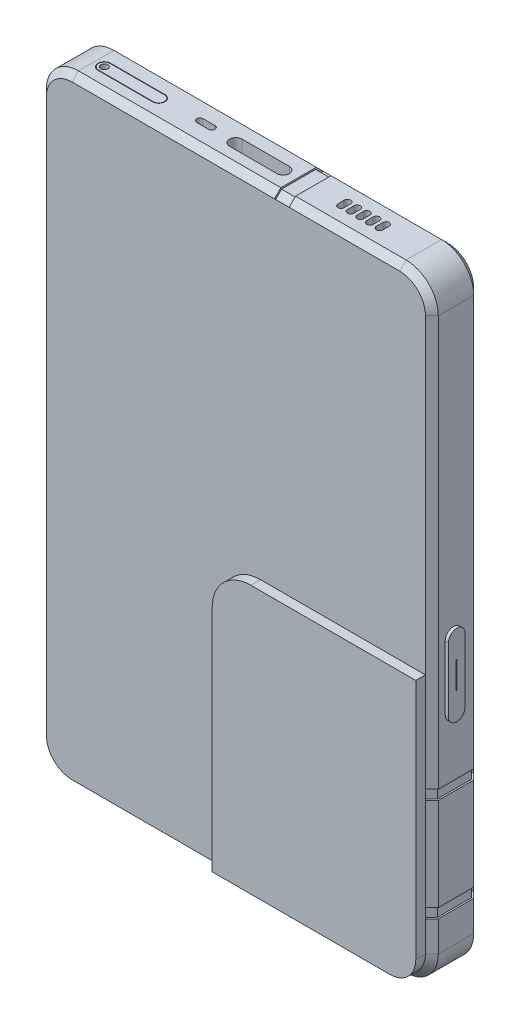
from build123d import *

# Parameters (mm, degrees)
EXTRUDE_1_DEPTH        = 15
CHAMFER_7_SIZE         = 2
CHAMFER_8_SIZE         = 2
CUT_EXTRUDE_1_DEPTH    = 6
PATTERN_LINEAR_1_COUNT = 5
PATTERN_LINEAR_1_PITCH = 3
CUT_EXTRUDE_2_DEPTH    = 10
CUT_EXTRUDE_3_DEPTH    = 40
CUT_EXTRUDE_5_DEPTH    = 20
EXTRUDE_2_DEPTH        = 20
SKETCH_9_R             = 1.114563032
CUT_EXTRUDE_6_DEPTH    = 20
SKETCH_10_R            = 2.990185925
CUT_EXTRUDE_8_DEPTH    = 20
SKETCH_12_W            = 4.560479379
SKETCH_12_H            = 11
CUT_EXTRUDE_9_DEPTH    = 0.5
SKETCH_13_W            = 4.560479379
SKETCH_13_H            = 2.828427125
CUT_EXTRUDE_10_DEPTH   = 0.5
SKETCH_14_W            = 4.560479379
SKETCH_14_H            = 2.828427125
CUT_EXTRUDE_11_DEPTH   = 0.5
EXTRUDE_3_DEPTH        = 1
EXTRUDE_4_DEPTH        = 0.1
SKETCH_17_W            = 11
SKETCH_17_H            = 3
CUT_EXTRUDE_12_DEPTH   = 0.5
SKETCH_18_W            = 2.828427124
SKETCH_18_H            = 3
CUT_EXTRUDE_13_DEPTH   = 0.5
SKETCH_19_W            = 2.828427124
SKETCH_19_H            = 3
CUT_EXTRUDE_14_DEPTH   = 0.5
EXTRUDE_5_DEPTH        = 0.5
SKETCH_26_W            = 11
SKETCH_26_H            = 4
CUT_EXTRUDE_15_DEPTH   = 0.5
SKETCH_27_W            = 2.828427124
SKETCH_27_H            = 4
CUT_EXTRUDE_16_DEPTH   = 0.5
SKETCH_28_W            = 2.828427124
SKETCH_28_H            = 4
CUT_EXTRUDE_17_DEPTH   = 0.5
EXTRUDE_6_DEPTH        = 3


with BuildPart() as part:
    # 草图1 → 凸台-拉伸1 (new body)
    with BuildSketch(Plane.XY):
        with BuildLine():
            Line((-50.87521941, 95.847945747), (50.87521941, 95.847945747))
            ThreePointArc((50.87521941, 95.847945747), (57.946287222, 92.919013559), (60.87521941, 85.847945747))
            Line((60.87521941, 85.847945747), (60.87521941, -85.847945747))
            ThreePointArc((60.87521941, -85.847945747), (57.946287222, -92.919013559), (50.87521941, -95.847945747))
            Line((50.87521941, -95.847945747), (-50.87521941, -95.847945747))
            ThreePointArc((-50.87521941, -95.847945747), (-57.946287222, -92.919013559), (-60.87521941, -85.847945747))
            Line((-60.87521941, -85.847945747), (-60.87521941, 85.847945747))
            ThreePointArc((-60.87521941, 85.847945747), (-57.946287222, 92.919013559), (-50.87521941, 95.847945747))
        make_face()
    extrude(amount=EXTRUDE_1_DEPTH)

    # 倒角7
    chamfer_7_edges = [part.edges().sort_by_distance(p)[0] for p in [
        (0, 95.847945747, 0),
        (57.946287222, 92.919013559, 0),
        (60.87521941, 0, 0),
        (57.946287222, -92.919013559, 0),
        (0, -95.847945747, 0),
        (-57.946287222, -92.919013559, 0),
        (-60.87521941, 0, 0),
        (-57.946287222, 92.919013559, 0),
    ]]
    chamfer(chamfer_7_edges, length=CHAMFER_7_SIZE)

    # 倒角8
    chamfer_8_edges = [part.edges().sort_by_distance(p)[0] for p in [
        (57.946287222, 92.919013559, 15),
        (0, 95.847945747, 15),
        (-57.946287222, 92.919013559, 15),
        (-60.87521941, 0, 15),
        (-57.946287222, -92.919013559, 15),
        (0, -95.847945747, 15),
        (57.946287222, -92.919013559, 15),
        (60.87521941, 0, 15),
    ]]
    chamfer(chamfer_8_edges, length=CHAMFER_8_SIZE)

    # 草图4 → 切除-拉伸1 (cut)
    with BuildSketch(Plane(origin=(0, 95.847945747, 0), x_dir=(1, 0, 0), z_dir=(0, 1, 0))):
        with BuildLine():
            Line((25.184922723, -6.52592521), (25.184922723, -8.52592521))
            ThreePointArc((25.184922723, -8.52592521), (26.184922723, -9.52592521), (27.184922723, -8.52592521))
            Line((27.184922723, -8.52592521), (27.184922723, -6.52592521))
            ThreePointArc((27.184922723, -6.52592521), (26.184922723, -5.52592521), (25.184922723, -6.52592521))
        make_face()
    cut_extrude_1 = extrude(amount=-CUT_EXTRUDE_1_DEPTH, mode=Mode.SUBTRACT)

    # 阵列(线性)1: 切除-拉伸1 ×5
    with Locations(*[(i * PATTERN_LINEAR_1_PITCH, 0, 0) for i in range(1, PATTERN_LINEAR_1_COUNT)]):
        add(cut_extrude_1, mode=Mode.SUBTRACT)

    # 草图5 → 切除-拉伸2 (cut)
    with BuildSketch(Plane(origin=(0, 95.847945747, 0), x_dir=(1, 0, 0), z_dir=(0, 1, 0))):
        with BuildLine():
            Line((-18.674903906, -6.52592521), (-14.956626917, -6.52592521))
            ThreePointArc((-14.956626917, -6.52592521), (-13.956626917, -7.52592521), (-14.956626917, -8.52592521))
            Line((-14.956626917, -8.52592521), (-18.674903906, -8.52592521))
            ThreePointArc((-18.674903906, -8.52592521), (-19.674903906, -7.52592521), (-18.674903906, -6.52592521))
        make_face()
    extrude(amount=-CUT_EXTRUDE_2_DEPTH, mode=Mode.SUBTRACT)

    # 草图6 → 切除-拉伸3 (cut)
    with BuildSketch(Plane(origin=(0, 95.847945747, 0), x_dir=(1, 0, 0), z_dir=(0, 1, 0))):
        with BuildLine():
            Line((-7.094079035, -5.954899544), (7.600798966, -5.954899544))
            ThreePointArc((7.600798966, -5.954899544), (9.543225368, -7.897325947), (7.600798966, -9.839752349))
            Line((7.600798966, -9.839752349), (-7.094079035, -9.839752349))
            ThreePointArc((-7.094079035, -9.839752349), (-9.036505437, -7.897325947), (-7.094079035, -5.954899544))
        make_face()
    extrude(amount=-CUT_EXTRUDE_3_DEPTH, mode=Mode.SUBTRACT)

    # 草图7 → 切除-拉伸5 (cut)
    with BuildSketch(Plane(origin=(0, 95.847945747, 0), x_dir=(1, 0, 0), z_dir=(0, 1, 0))):
        with BuildLine():
            Line((-47.943352298, -5.954899544), (-31.050839612, -5.954899544))
            ThreePointArc((-31.050839612, -5.954899544), (-29.108413209, -7.897325947), (-31.050839612, -9.839752349))
            Line((-31.050839612, -9.839752349), (-47.943352298, -9.839752349))
            ThreePointArc((-47.943352298, -9.839752349), (-49.885778701, -7.897325947), (-47.943352298, -5.954899544))
        make_face()
    extrude(amount=-CUT_EXTRUDE_5_DEPTH, mode=Mode.SUBTRACT)

    # 草图8 → 凸台-拉伸2 (add)
    with BuildSketch(Plane(origin=(0, 75.847945747, 0), x_dir=(1, 0, 0), z_dir=(0, 1, 0))):
        with BuildLine():
            Line((-47.943352298, -6.108012441), (-31.050839612, -6.108012441))
            ThreePointArc((-31.050839612, -6.108012441), (-29.259969658, -7.898882395), (-31.050839612, -9.689752349))
            Line((-31.050839612, -9.689752349), (-47.943352298, -9.689752349))
            ThreePointArc((-47.943352298, -9.689752349), (-49.734222253, -7.898882395), (-47.943352298, -6.108012441))
        make_face()
    extrude(amount=EXTRUDE_2_DEPTH)

    # 草图9 → 切除-拉伸6 (cut)
    with BuildSketch(Plane(origin=(0, 95.847945747, 0), x_dir=(1, 0, 0), z_dir=(0, 1, 0))):
        with Locations(Location((-47.943352298, -7.898882395, 0), (0, 0, 270))):
            Circle(SKETCH_9_R)
    extrude(amount=-CUT_EXTRUDE_6_DEPTH, mode=Mode.SUBTRACT)

    # 草图10 → 切除-拉伸8 (cut)
    with BuildSketch(Plane.XZ.offset(95.847945747)):
        with Locations(Location((47.885033485, 7.5, 0), (0, 0, 270))):
            Circle(SKETCH_10_R)
        with BuildLine():
            Line((-8.945418448, 10.490185925), (-20.268797242, 10.490185925))
            ThreePointArc((-20.268797242, 10.490185925), (-23.258983167, 7.5), (-20.268797242, 4.509814075))
            Line((-20.268797242, 4.509814075), (-8.945418448, 4.509814075))
            ThreePointArc((-8.945418448, 4.509814075), (-5.955232523, 7.5), (-8.945418448, 10.490185925))
        make_face()
    extrude(amount=-CUT_EXTRUDE_8_DEPTH, mode=Mode.SUBTRACT)

    # 草图12 → 切除-拉伸9 (cut)
    with BuildSketch(Plane(origin=(0, 95.847945747, 0), x_dir=(1, 0, 0), z_dir=(0, 1, 0))):
        with Locations((14.272611391, -7.5)):
            Rectangle(SKETCH_12_W, SKETCH_12_H)
    extrude(amount=-CUT_EXTRUDE_9_DEPTH, mode=Mode.SUBTRACT)

    # 草图13 → 切除-拉伸10 (cut)
    with BuildSketch(Plane(origin=(0, 54.423972873, 54.423972873), x_dir=(1, 0, 0), z_dir=(0, 0.7071067811865452, 0.7071067811865498))):
        with Locations((14.272611391, 57.168130683)):
            Rectangle(SKETCH_13_W, SKETCH_13_H)
    extrude(amount=-CUT_EXTRUDE_10_DEPTH, mode=Mode.SUBTRACT)

    # 草图14 → 切除-拉伸11 (cut)
    with BuildSketch(Plane(origin=(0, 46.923972873, -46.923972873), x_dir=(1, 0, 0), z_dir=(0, 0.707106781186545, -0.70710678118655))):
        with Locations((14.272611391, -67.7747324)):
            Rectangle(SKETCH_14_W, SKETCH_14_H)
    extrude(amount=-CUT_EXTRUDE_11_DEPTH, mode=Mode.SUBTRACT)

    # 草图15 → 凸台-拉伸3 (add)
    with BuildSketch(Plane(origin=(60.87521941, 0, 0), x_dir=(0, 0, -1), z_dir=(1, 0, 0))):
        with BuildLine():
            Line((-10.846864794, -2.667254546), (-10.846864794, -22.628643405))
            ThreePointArc((-10.846864794, -22.628643405), (-8.265650718, -25.209857481), (-5.684436641, -22.628643405))
            Line((-5.684436641, -22.628643405), (-5.684436641, -2.667254546))
            ThreePointArc((-5.684436641, -2.667254546), (-8.265650718, -0.086040469), (-10.846864794, -2.667254546))
        make_face()
    extrude(amount=EXTRUDE_3_DEPTH)

    # 草图16 → 凸台-拉伸4 (add)
    with BuildSketch(Plane(origin=(61.87521941, 0, 0), x_dir=(0, 0, -1), z_dir=(1, 0, 0))):
        with BuildLine():
            Line((-8.465650718, -8.647948975), (-8.465650718, -16.647948975))
            ThreePointArc((-8.465650718, -16.647948975), (-8.265650718, -16.847948975), (-8.065650718, -16.647948975))
            Line((-8.065650718, -16.647948975), (-8.065650718, -8.647948975))
            ThreePointArc((-8.065650718, -8.647948975), (-8.265650718, -8.447948975), (-8.465650718, -8.647948975))
        make_face()
    extrude(amount=EXTRUDE_4_DEPTH)

    # 草图17 → 切除-拉伸12 (cut)
    with BuildSketch(Plane(origin=(60.87521941, 0, 0), x_dir=(0, 0, -1), z_dir=(1, 0, 0))):
        with Locations((-7.5, -74.859598899)):
            Rectangle(SKETCH_17_W, SKETCH_17_H)
        with Locations((-7.5, -43.013411788)):
            Rectangle(SKETCH_17_W, SKETCH_17_H)
    extrude(amount=-CUT_EXTRUDE_12_DEPTH, mode=Mode.SUBTRACT)

    # 草图18 → 切除-拉伸13 (cut)
    with BuildSketch(Plane(origin=(29.437609705, 0, -29.437609705), x_dir=(-0.7071067811865475, 0, -0.7071067811865477), z_dir=(0.7071067811865477, 0, -0.7071067811865475))):
        with Locations((-43.045280451, -43.013411788)):
            Rectangle(SKETCH_18_W, SKETCH_18_H)
        with Locations((-43.045280451, -74.859598899)):
            Rectangle(SKETCH_18_W, SKETCH_18_H)
    extrude(amount=-CUT_EXTRUDE_13_DEPTH, mode=Mode.SUBTRACT)

    # 草图19 → 切除-拉伸14 (cut)
    with BuildSketch(Plane(origin=(36.937609705, 0, 36.937609705), x_dir=(0.7071067811865498, 0, -0.7071067811865452), z_dir=(0.7071067811865452, 0, 0.7071067811865498))):
        with Locations((32.438678733, -43.013411788)):
            Rectangle(SKETCH_19_W, SKETCH_19_H)
        with Locations((32.438678733, -74.859598899)):
            Rectangle(SKETCH_19_W, SKETCH_19_H)
    extrude(amount=-CUT_EXTRUDE_14_DEPTH, mode=Mode.SUBTRACT)

    # 草图25 → 凸台-拉伸5 (add)
    with BuildSketch(Plane.ZY.offset(60.87521941)):
        with BuildLine():
            Line((5.092196702, -20.703608048), (5.092196702, -32.703608048))
            ThreePointArc((5.092196702, -32.703608048), (6.87745097, -34.488862317), (8.662705239, -32.703608048))
            Line((8.662705239, -32.703608048), (8.662705239, -20.703608048))
            ThreePointArc((8.662705239, -20.703608048), (6.87745097, -18.91835378), (5.092196702, -20.703608048))
        make_face()
        with BuildLine():
            Line((5.092196702, -37.703608048), (5.092196702, -49.703608048))
            ThreePointArc((5.092196702, -49.703608048), (6.87745097, -51.488862317), (8.662705239, -49.703608048))
            Line((8.662705239, -49.703608048), (8.662705239, -37.703608048))
            ThreePointArc((8.662705239, -37.703608048), (6.87745097, -35.91835378), (5.092196702, -37.703608048))
        make_face()
    extrude(amount=EXTRUDE_5_DEPTH)

    # 草图26 → 切除-拉伸15 (cut)
    with BuildSketch(Plane.ZY.offset(60.87521941)):
        with Locations((7.5, -67.142133824)):
            Rectangle(SKETCH_26_W, SKETCH_26_H)
    extrude(amount=-CUT_EXTRUDE_15_DEPTH, mode=Mode.SUBTRACT)

    # 草图27 → 切除-拉伸16 (cut)
    with BuildSketch(Plane(origin=(-36.937609705, 0, 36.937609705), x_dir=(0.7071067811865498, 0, 0.7071067811865452), z_dir=(-0.7071067811865452, 0, 0.7071067811865498))):
        with Locations((-32.438678733, -67.142133824)):
            Rectangle(SKETCH_27_W, SKETCH_27_H)
    extrude(amount=-CUT_EXTRUDE_16_DEPTH, mode=Mode.SUBTRACT)

    # 草图28 → 切除-拉伸17 (cut)
    with BuildSketch(Plane(origin=(-29.437609705, 0, -29.437609705), x_dir=(-0.7071067811865475, 0, 0.7071067811865477), z_dir=(-0.7071067811865477, 0, -0.7071067811865475))):
        with Locations((43.045280451, -67.142133824)):
            Rectangle(SKETCH_28_W, SKETCH_28_H)
    extrude(amount=-CUT_EXTRUDE_17_DEPTH, mode=Mode.SUBTRACT)

    # 草图30 → 凸台-拉伸6 (add)
    with BuildSketch(Plane.XY.offset(15)):
        with BuildLine():
            Line((-4.346185338, -93.847945747), (-4.346185338, -22.755058652))
            ThreePointArc((-4.346185338, -22.755058652), (-0.831466712, -14.269777278), (7.653814662, -10.755058652))
            Line((7.653814662, -10.755058652), (58.87521941, -10.755058652))
            Line((58.87521941, -10.755058652), (58.87521941, -85.847945747))
            ThreePointArc((58.87521941, -85.847945747), (56.532073659, -91.504799996), (50.87521941, -93.847945747))
            Line((50.87521941, -93.847945747), (-4.346185338, -93.847945747))
        make_face()
    extrude(amount=EXTRUDE_6_DEPTH)


solid = part.part
